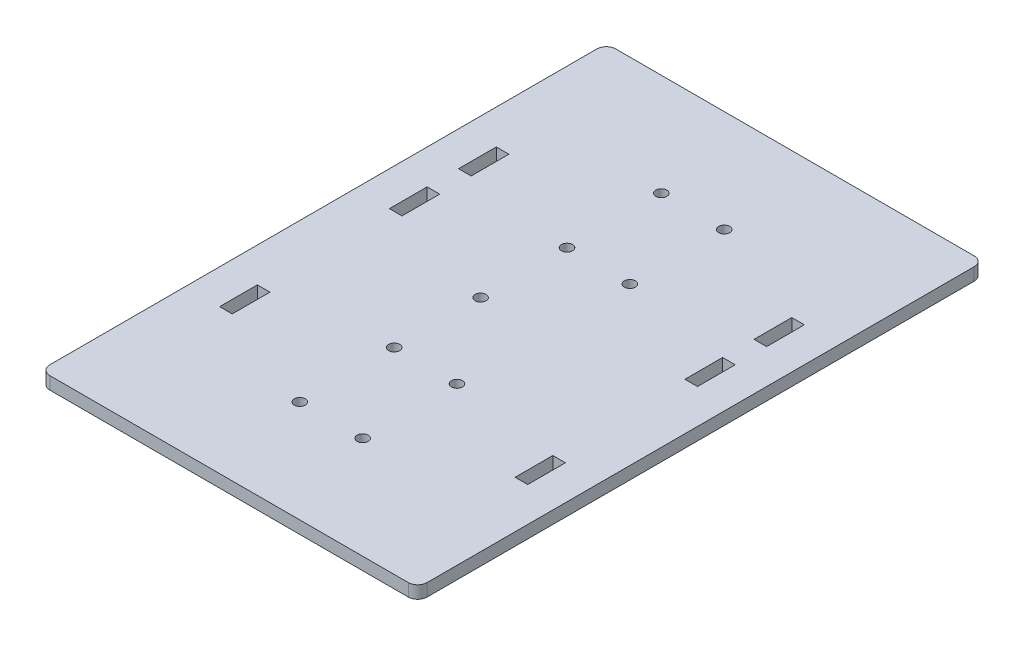
from build123d import *

# Parameters (mm, degrees)
SKETCH1_W           = 120
SKETCH1_H           = 180
SKETCH1_R           = 1.75
SKETCH1_W_2         = 4
SKETCH1_H_2         = 12
BOSS_EXTRUDE1_DEPTH = 4
FILLET1_R           = 3


with BuildPart() as part:
    # Sketch1 → Boss-Extrude1 (new body)
    with BuildSketch(Plane(origin=(0, 0, 0), x_dir=(1, 0, 0), z_dir=(0, 1, 0))):
        Rectangle(SKETCH1_W, SKETCH1_H)
        with Locations(Location((-10, 57.5, 0), (0, 0, 270))):
            Circle(SKETCH1_R, mode=Mode.SUBTRACT)
        with Locations(Location((10, 57.5, 0), (0, 0, 270))):
            Circle(SKETCH1_R, mode=Mode.SUBTRACT)
        with Locations(Location((10, 27.5, 0), (0, 0, 270))):
            Circle(SKETCH1_R, mode=Mode.SUBTRACT)
        with Locations(Location((-10, 27.5, 0), (0, 0, 270))):
            Circle(SKETCH1_R, mode=Mode.SUBTRACT)
        with Locations(Location((10, -27.5, 0), (0, 0, 90))):
            Circle(SKETCH1_R, mode=Mode.SUBTRACT)
        with Locations(Location((-10, -27.5, 0), (0, 0, 90))):
            Circle(SKETCH1_R, mode=Mode.SUBTRACT)
        with Locations(Location((10, -57.5, 0), (0, 0, 90))):
            Circle(SKETCH1_R, mode=Mode.SUBTRACT)
        with Locations(Location((-10, -57.5, 0), (0, 0, 90))):
            Circle(SKETCH1_R, mode=Mode.SUBTRACT)
        with Locations(Location((-10, 0, 0), (0, 0, 270))):
            Circle(SKETCH1_R, mode=Mode.SUBTRACT)
        with Locations((-47, 16)):
            Rectangle(SKETCH1_W_2, SKETCH1_H_2, mode=Mode.SUBTRACT)
        with Locations((-47, 38)):
            Rectangle(SKETCH1_W_2, SKETCH1_H_2, mode=Mode.SUBTRACT)
        with Locations((-47, -38)):
            Rectangle(SKETCH1_W_2, SKETCH1_H_2, mode=Mode.SUBTRACT)
        with Locations((47, -38)):
            Rectangle(SKETCH1_W_2, SKETCH1_H_2, mode=Mode.SUBTRACT)
        with Locations((47, 16)):
            Rectangle(SKETCH1_W_2, SKETCH1_H_2, mode=Mode.SUBTRACT)
        with Locations((47, 38)):
            Rectangle(SKETCH1_W_2, SKETCH1_H_2, mode=Mode.SUBTRACT)
    extrude(amount=BOSS_EXTRUDE1_DEPTH)

    # Fillet1
    fillet1_edges = [part.edges().sort_by_distance(p)[0] for p in [
        (60, 2, 90),
        (-60, 2, 90),
        (-60, 2, -90),
        (60, 2, -90),
    ]]
    fillet(fillet1_edges, radius=FILLET1_R)


solid = part.part
